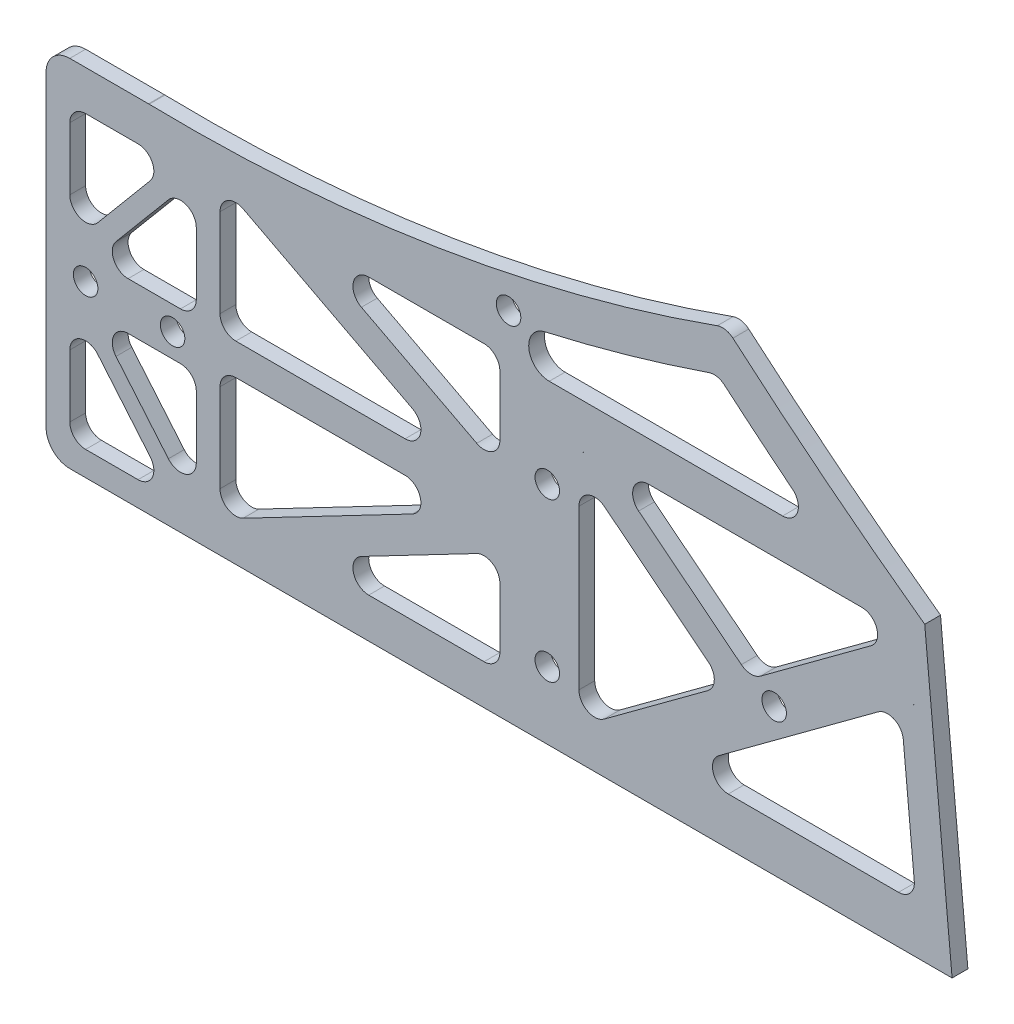
from build123d import *

# Parameters (mm, degrees)
SKETCH_1_W           = 165
SKETCH_1_H           = 57
EXTRUDE_1_DEPTH      = 2
CUT_EXTRUDE_1_DEPTH  = 6
SKETCH_4_R           = 1.55
CUT_EXTRUDE_3_DEPTH  = 33
SKETCH_8_R           = 1.55
CUT_EXTRUDE_5_DEPTH  = 10
SKETCH_9_R           = 1.55
CUT_EXTRUDE_6_DEPTH  = 10
FILLET_3_R           = 2
FILLET_4_R           = 2
CUT_EXTRUDE_7_DEPTH  = 10
FILLET_8_R           = 2
CUT_EXTRUDE_8_DEPTH  = 10
FILLET_9_R           = 2
CUT_EXTRUDE_9_DEPTH  = 10
FILLET_10_R          = 2
EXTRUDE_4_DEPTH      = 2
FILLET_11_R          = 2
EXTRUDE_5_DEPTH      = 2
FILLET_12_R          = 2
CUT_EXTRUDE_10_DEPTH = 10
EXTRUDE_6_DEPTH      = 2
FILLET_13_R          = 3
SKETCH_18_R          = 1.55
CUT_EXTRUDE_12_DEPTH = 2
FILLET_14_R          = 2


with BuildPart() as part:
    # 草图1 → 凸台-拉伸1 (new body)
    with BuildSketch(Plane.XY):
        Rectangle(SKETCH_1_W, SKETCH_1_H)
    extrude(amount=EXTRUDE_1_DEPTH)

    # 草图2 → 切除-拉伸1 (cut)
    with BuildSketch(Plane.XY.offset(2)):
        with BuildLine():
            Line((82.5, 28.5), (-7.5, 28.5))
            ThreePointArc((-7.5, 28.5), (35.318614374, -3.444293093), (82.5, -28.5))
            Line((82.5, -28.5), (82.5, 28.5))
        make_face()
        with BuildLine():
            Line((-82.5, 28.5), (-82.5, 16.5))
            ThreePointArc((-82.5, 16.5), (-44.425115885, 18.906974283), (-7.5, 28.5))
            Line((-7.5, 28.5), (-82.5, 28.5))
        make_face()
    extrude(amount=-CUT_EXTRUDE_1_DEPTH, mode=Mode.SUBTRACT)

    # 草图4 → 切除-拉伸3 (cut)
    with BuildSketch(Plane.XY.offset(2)):
        with Locations((-77.5, -7)):
            Circle(SKETCH_4_R)
    extrude(amount=-CUT_EXTRUDE_3_DEPTH, mode=Mode.SUBTRACT)

    # 草图8 → 切除-拉伸5 (cut)
    with BuildSketch(Plane.XY.offset(2)):
        with Locations((-1.4, -10)):
            Circle(SKETCH_8_R)
        with Locations((-30.1, -20)):
            Circle(SKETCH_8_R)
        with Locations((-30.1, 0)):
            Circle(SKETCH_8_R)
    extrude(amount=-CUT_EXTRUDE_5_DEPTH, mode=Mode.SUBTRACT)

    # 草图9 → 切除-拉伸6 (cut)
    with BuildSketch(Plane(origin=(0, 0, 0), x_dir=(-1, 0, 0), z_dir=(0, 0, -1))):
        with Locations((35, 16.562431315)):
            Circle(SKETCH_9_R)
        with Locations((-40, -14.583150631)):
            Circle(SKETCH_9_R)
    extrude(amount=-CUT_EXTRUDE_6_DEPTH, mode=Mode.SUBTRACT)

    # 圆角3
    fillet_3_edges = [part.edges().sort_by_distance(p)[0] for p in [
        (-7.5, 28.5, 1),
    ]]
    fillet(fillet_3_edges, radius=FILLET_3_R)

    # 圆角4
    fillet_4_edges = [part.edges().sort_by_distance(p)[0] for p in [
        (-82.5, 16.5, 1),
        (-82.5, -28.5, 1),
    ]]
    fillet(fillet_4_edges, radius=FILLET_4_R)

    # 草图10 → 切除-拉伸7 (cut)
    with BuildSketch(Plane.XY.offset(2)):
        with BuildLine():
            Line((-29.849630584, 11.395100666), (5.446787044, 11.395100666))
            ThreePointArc((5.446787044, 11.395100666), (-1.632648985, 17.014079013), (-8.566742511, 22.811464555))
            ThreePointArc((-8.566742511, 22.811464555), (-19.410140236, 19.367286283), (-30.427912484, 16.529975425))
            ThreePointArc((-30.427912484, 16.529975425), (-32.433297975, 13.704131917), (-29.849630584, 11.395100666))
        make_face()
    extrude(amount=-CUT_EXTRUDE_7_DEPTH, mode=Mode.SUBTRACT)

    # 圆角8
    fillet_8_edges = [part.edges().sort_by_distance(p)[0] for p in [
        (-8.566742511, 22.811464555, 1),
        (5.446787044, 11.395100666, 1),
    ]]
    fillet(fillet_8_edges, radius=FILLET_8_R)

    # 草图11 → 切除-拉伸8 (cut)
    with BuildSketch(Plane.XY.offset(2)):
        Polygon((-36.1, -23.450877229), (-60.842981063, -23.450877229), (-36.1, -10.539715916), align=None)
        Polygon((-39.932804883, -8.027888281), (-71.5, -8.027888281), (-71.5, -24.5), align=None)
        Polygon((-39.932804883, -4.027888281), (-71.5, 12.444223438), (-71.5, -4.027888281), align=None)
        Polygon((-36.1, -1.516060646), (-36.1, 11.395100666), (-60.842981063, 11.395100666), align=None)
    extrude(amount=-CUT_EXTRUDE_8_DEPTH, mode=Mode.SUBTRACT)

    # 圆角9
    fillet_9_edges = [part.edges().sort_by_distance(p)[0] for p in [
        (-39.932804883, -8.027888281, 1),
        (-71.5, -24.5, 1),
        (-71.5, -8.027888281, 1),
        (-39.932804883, -4.027888281, 1),
        (-71.5, -4.027888281, 1),
        (-71.5, 12.444223438, 1),
        (-36.1, 11.395100666, 1),
        (-36.1, -1.516060646, 1),
        (-60.842981063, 11.395100666, 1),
        (-36.1, -23.450877229, 1),
        (-60.842981063, -23.450877229, 1),
        (-36.1, -10.539715916, 1),
    ]]
    fillet(fillet_9_edges, radius=FILLET_9_R)

    # 草图12 → 切除-拉伸9 (cut)
    with BuildSketch(Plane.XY.offset(2)):
        with BuildLine():
            Line((-26.1, 6.395100666), (-26.1, -24.5))
            Line((-26.1, -24.5), (10.872926165, 2.785876305))
            ThreePointArc((10.872926165, 2.785876305), (11.585120693, 5.020221166), (9.68532482, 6.395100666))
            Line((9.68532482, 6.395100666), (-26.1, 6.395100666))
        make_face()
        with BuildLine():
            Line((16.519718688, -0.503821347), (-13.285557865, -22.5))
            Line((-13.285557865, -22.5), (51.996010319, -22.5))
            ThreePointArc((51.996010319, -22.5), (33.937003057, -12.019408482), (16.519718688, -0.503821347))
        make_face()
    extrude(amount=-CUT_EXTRUDE_9_DEPTH, mode=Mode.SUBTRACT)

    # 圆角10
    fillet_10_edges = [part.edges().sort_by_distance(p)[0] for p in [
        (16.519718688, -0.503821347, 1),
        (51.996010319, -22.5, 1),
        (-13.285557865, -22.5, 1),
        (-26.1, 6.395100666, 1),
        (-26.1, -24.5, 1),
    ]]
    fillet(fillet_10_edges, radius=FILLET_10_R)

    # 草图13 → 凸台-拉伸4 (add)
    with BuildSketch(Plane.XY.offset(2)):
        Polygon((-26.758433391, 4.243454395), (-7.263956073, -11.246702958), (-4.352943402, -8.450756462), (-24.269993734, 7.375174063), align=None)
    extrude(amount=-EXTRUDE_4_DEPTH)

    # 圆角11
    fillet_11_edges = [part.edges().sort_by_distance(p)[0] for p in [
        (-26.1, 3.720268435, 1),
        (-7.686529087, -10.910929786, 1),
        (-4.352943402, -8.450756462, 1),
        (-23.036564134, 6.395100666, 1),
    ]]
    fillet(fillet_11_edges, radius=FILLET_11_R)

    # 草图14 → 凸台-拉伸5 (add)
    with BuildSketch(Plane.XY.offset(2)):
        Polygon((14.53207819, -1.153752135), (16.546586595, -22.68629933), (20.546624568, -22.5), (18.514686662, -0.781153475), align=None)
    extrude(amount=-EXTRUDE_5_DEPTH)

    # 圆角12
    fillet_12_edges = [part.edges().sort_by_distance(p)[0] for p in [
        (14.603571968, -1.917930204, 1),
        (16.529157093, -22.5, 1),
        (20.546624568, -22.5, 1),
        (18.626422966, -1.975473255, 1),
    ]]
    fillet(fillet_12_edges, radius=FILLET_12_R)

    # 草图15 → 切除-拉伸10 (cut)
    with BuildSketch(Plane.XY.offset(2)):
        with BuildLine():
            Line((21.107963193, -28.5), (17.644547538, 8.519533342))
            ThreePointArc((17.644547538, 8.519533342), (49.082122431, -11.724904385), (82.5, -28.5))
            Line((82.5, -28.5), (21.107963193, -28.5))
        make_face()
    extrude(amount=-CUT_EXTRUDE_10_DEPTH, mode=Mode.SUBTRACT)

    # 草图17 → 凸台-拉伸6 (add)
    with BuildSketch(Plane.XY.offset(2)):
        Polygon((-80.455675407, 16.444223438), (-93.5, 16.444223438), (-93.5, -28.5), (-80.442860064, -28.5), align=None)
    extrude(amount=-EXTRUDE_6_DEPTH)

    # 圆角13
    fillet_13_edges = [part.edges().sort_by_distance(p)[0] for p in [
        (-93.5, -28.5, 1),
        (-93.5, 16.444223438, 1),
    ]]
    fillet(fillet_13_edges, radius=FILLET_13_R)

    # 草图18 → 切除-拉伸12 (cut)
    with BuildSketch(Plane.XY.offset(2)):
        with Locations((-88.5, -7)):
            Circle(SKETCH_18_R)
        Polygon((-74.5, -4), (-87.418023291, -4), (-74.5, 11.395100666), align=None)
        Polygon((-90.5, 11.395100666), (-90.5, -4), (-77.581976709, 11.395100666), align=None)
        Polygon((-87.418023291, -10), (-74.5, -25.395100666), (-74.5, -10), align=None)
        Polygon((-90.5, -10), (-77.581976709, -25.395100666), (-90.5, -25.395100666), align=None)
    extrude(amount=-CUT_EXTRUDE_12_DEPTH, mode=Mode.SUBTRACT)

    # 圆角14
    fillet_14_edges = [part.edges().sort_by_distance(p)[0] for p in [
        (-87.418023291, -10, 1),
        (-74.5, -10, 1),
        (-74.5, -25.395100666, 1),
        (-90.5, -25.395100666, 1),
        (-90.5, -10, 1),
        (-77.581976709, -25.395100666, 1),
        (-74.5, 11.395100666, 1),
        (-74.5, -4, 1),
        (-87.418023291, -4, 1),
        (-90.5, 11.395100666, 1),
        (-77.581976709, 11.395100666, 1),
        (-90.5, -4, 1),
    ]]
    fillet(fillet_14_edges, radius=FILLET_14_R)


solid = part.part
